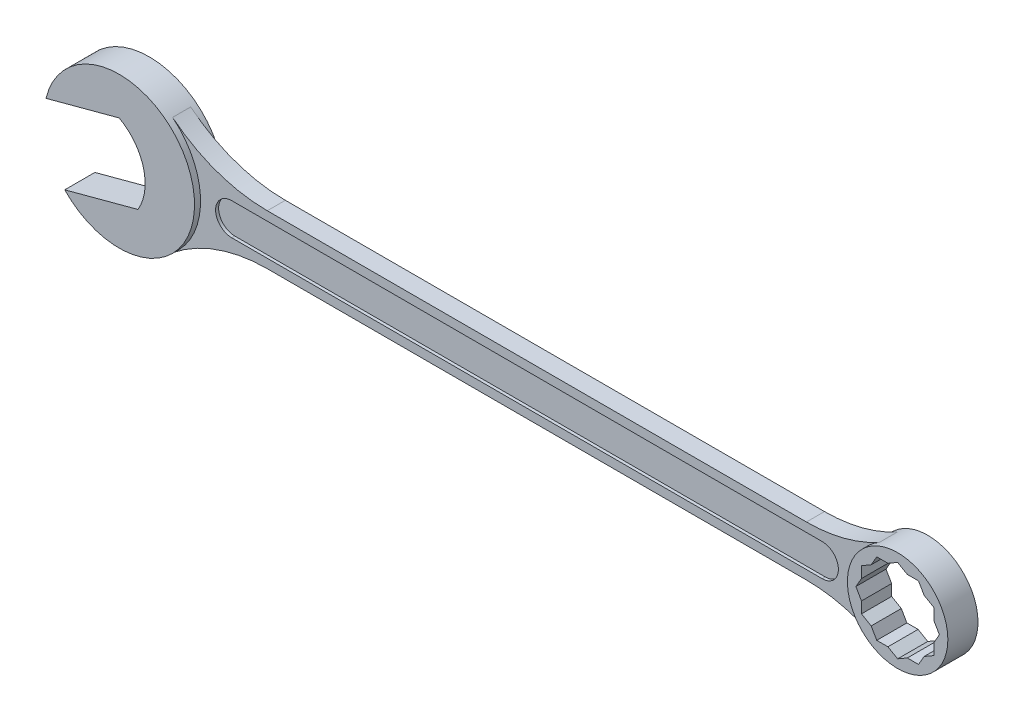
from build123d import *

# Parameters (mm, degrees)
BOSS_EXTRUDE1_DEPTH   = 5
SKETCH1_R             = 16.666666667
BOSS_EXTRUDE1_2_DEPTH = 5
BOSS_EXTRUDE2_DEPTH   = 3
BOSS_EXTRUDE3_DEPTH   = 2


with BuildPart() as part:
    # Sketch1 → Boss-Extrude1 (new, symmetric)
    with BuildSketch(Plane.XY):
        with BuildLine():
            ThreePointArc((-18.078578687, -17.267454724), (24.148145657, 6.470476128), (-24.290235769, 5.914765107))
            Line((-24.290235769, 5.914765107), (0.016914075, 12.427846278))
            ThreePointArc((0.016914075, 12.427846278), (8.049381886, 2.156825376), (6.228571158, -10.754373553))
            Line((6.228571158, -10.754373553), (-18.078578687, -17.267454724))
        make_face()
    extrude(amount=BOSS_EXTRUDE1_DEPTH, both=True)



with BuildPart() as body_2:
    # Sketch1 → Boss-Extrude1 2 (new, symmetric)
    with BuildSketch(Plane.XY):
        with Locations((258.333333333, 0)):
            Circle(SKETCH1_R)
        Polygon((251.405130103, 12), (255.117943024, 12), (258.333333333, 13.856406461), (261.548723643, 12), (265.261536564, 12), (267.117943024, 8.784609691), (270.333333333, 6.92820323), (270.333333333, 3.215390309), (272.189739794, 0), (270.333333333, -3.215390309), (270.333333333, -6.92820323), (267.117943024, -8.784609691), (265.261536564, -12), (261.548723643, -12), (258.333333333, -13.856406461), (255.117943024, -12), (251.405130103, -12), (249.548723643, -8.784609691), (246.333333333, -6.92820323), (246.333333333, -3.215390309), (244.476926873, 0), (246.333333333, 3.215390309), (246.333333333, 6.92820323), (249.548723643, 8.784609691), align=None, mode=Mode.SUBTRACT)
    extrude(amount=BOSS_EXTRUDE1_2_DEPTH, both=True)


with BuildPart() as part_1:
    add(part.part)

    add(body_2.part)  # Boss-Extrude2 merges body 2
    # Sketch1<3> → Boss-Extrude2 (add, symmetric)
    with BuildSketch(Plane.XY):
        with BuildLine():
            ThreePointArc((47.140452079, 8.333333333), (30.473785412, 11.192881254), (15.713484026, 19.444444444))
            ThreePointArc((15.713484026, 19.444444444), (25, 0), (15.713484026, -19.444444444))
            ThreePointArc((15.713484026, -19.444444444), (30.473785412, -11.192881254), (47.140452079, -8.333333333))
            Line((47.140452079, -8.333333333), (226.058472115, -8.333333333))
            ThreePointArc((226.058472115, -8.333333333), (238.558472115, -9.921041506), (250.264618029, -14.583333333))
            ThreePointArc((250.264618029, -14.583333333), (241.666666667, 0), (250.264618029, 14.583333333))
            ThreePointArc((250.264618029, 14.583333333), (238.558472115, 9.921041506), (226.058472115, 8.333333333))
            Line((226.058472115, 8.333333333), (47.140452079, 8.333333333))
        make_face()
        with BuildLine():
            ThreePointArc((35.333333333, -5.333333333), (30, 0), (35.333333333, 5.333333333))
            Line((35.333333333, 5.333333333), (231.333333333, 5.333333333))
            ThreePointArc((231.333333333, 5.333333333), (236.666666667, 0), (231.333333333, -5.333333333))
            Line((231.333333333, -5.333333333), (35.333333333, -5.333333333))
        make_face(mode=Mode.SUBTRACT)
    extrude(amount=BOSS_EXTRUDE2_DEPTH, both=True)

    # Sketch1<4> → Boss-Extrude3 (add, symmetric)
    with BuildSketch(Plane.XY):
        with BuildLine():
            Line((231.333333333, 5.333333333), (35.333333333, 5.333333333))
            ThreePointArc((35.333333333, 5.333333333), (30, 0), (35.333333333, -5.333333333))
            Line((35.333333333, -5.333333333), (231.333333333, -5.333333333))
            ThreePointArc((231.333333333, -5.333333333), (236.666666667, 0), (231.333333333, 5.333333333))
        make_face()
    extrude(amount=BOSS_EXTRUDE3_DEPTH, both=True)


solid = part_1.part
